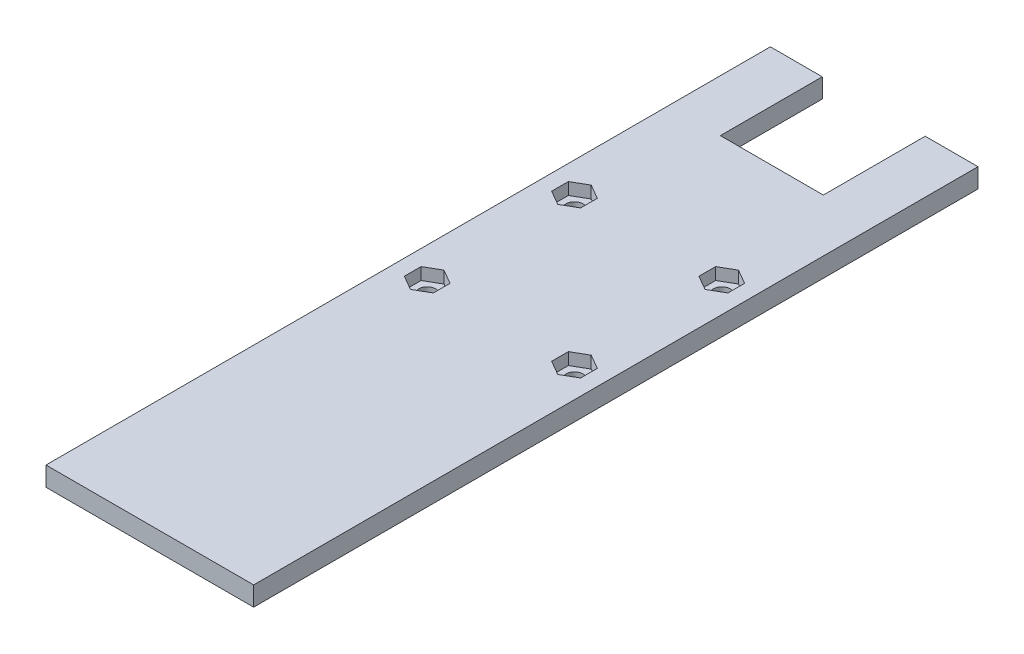
from build123d import *

# Parameters (mm, degrees)
SKETCH1_W           = 43
SKETCH1_H           = 150
BOSS_EXTRUDE1_DEPTH = 4
SKETCH2_W           = 10.57
SKETCH2_H           = 21.1
SKETCH2_W_2         = 10.75
CUT_EXTRUDE1_DEPTH  = 79.123299982
CUT_EXTRUDE2_DEPTH  = 2.5
SKETCH4_R           = 1.75
CUT_EXTRUDE3_DEPTH  = 79.123299982


with BuildPart() as part:
    # Sketch1 → Boss-Extrude1 (new body)
    with BuildSketch(Plane(origin=(0, 0, 0), x_dir=(1, 0, 0), z_dir=(0, 1, 0))):
        Rectangle(SKETCH1_W, SKETCH1_H)
    extrude(amount=BOSS_EXTRUDE1_DEPTH)

    # Sketch2 → Cut-Extrude1 (cut, through all)
    with BuildSketch(Plane(origin=(0, 4, 0), x_dir=(1, 0, 0), z_dir=(0, 1, 0))):
        with Locations((5.285, 64.45)):
            Rectangle(SKETCH2_W, SKETCH2_H)
        with Locations((-5.375, 64.45)):
            Rectangle(SKETCH2_W_2, SKETCH2_H)
    extrude(amount=-CUT_EXTRUDE1_DEPTH, mode=Mode.SUBTRACT)

    # Sketch3 → Cut-Extrude2 (cut)
    with BuildSketch(Plane(origin=(0, 4, 0), x_dir=(1, 0, 0), z_dir=(0, 1, 0))):
        Polygon((-15.25, 31.654101615), (-18.25, 29.922050808), (-18.25, 26.457949192), (-15.25, 24.725898385), (-12.25, 26.457949192), (-12.25, 29.922050808), align=None)
        Polygon((12.25, 29.922050808), (15.25, 31.654101615), (18.25, 29.922050808), (18.25, 26.457949192), (15.25, 24.725898385), (12.25, 26.457949192), align=None)
        Polygon((12.25, -0.577949192), (12.25, -4.042050808), (15.25, -5.774101615), (18.25, -4.042050808), (18.25, -0.577949192), (15.25, 1.154101615), align=None)
        Polygon((-12.25, -4.042050808), (-15.25, -5.774101615), (-18.25, -4.042050808), (-18.25, -0.577949192), (-15.25, 1.154101615), (-12.25, -0.577949192), align=None)
    extrude(amount=-CUT_EXTRUDE2_DEPTH, mode=Mode.SUBTRACT)

    # Sketch4 → Cut-Extrude3 (cut, through all)
    with BuildSketch(Plane(origin=(0, 4, 0), x_dir=(1, 0, 0), z_dir=(0, 1, 0))):
        with Locations(Location((-15.25, 28.19, 0), (0, 0, 270))):
            Circle(SKETCH4_R)
        with Locations(Location((15.25, 28.19, 0), (0, 0, 90))):
            Circle(SKETCH4_R)
        with Locations(Location((15.25, -2.31, 0), (0, 0, 270))):
            Circle(SKETCH4_R)
        with Locations(Location((-15.25, -2.31, 0), (0, 0, 90))):
            Circle(SKETCH4_R)
    extrude(amount=-CUT_EXTRUDE3_DEPTH, mode=Mode.SUBTRACT)


solid = part.part
